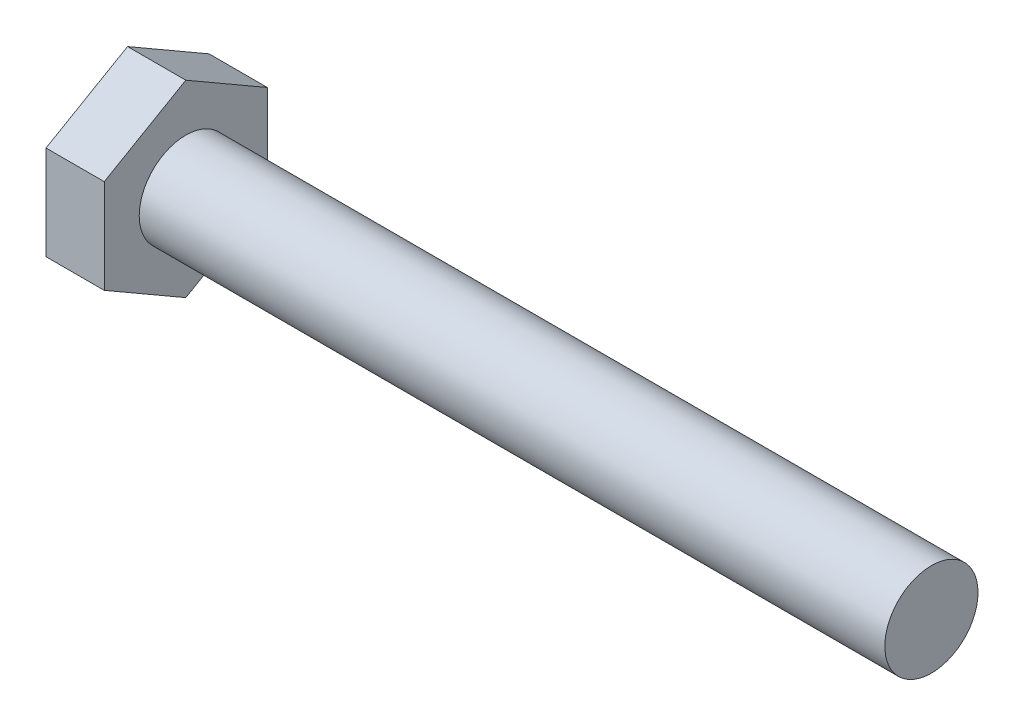
from build123d import *

# Parameters (mm, degrees)
SKETCH5_R           = 3.175
BOSS_EXTRUDE3_DEPTH = 50.8
BOSS_EXTRUDE4_DEPTH = 3.96875


with BuildPart() as part:
    # Sketch5 → Boss-Extrude3 (new body)
    with BuildSketch(Plane(origin=(27.384375, 0, 0), x_dir=(0, 0, -1), z_dir=(1, 0, 0))):
        Circle(SKETCH5_R)
    extrude(amount=-BOSS_EXTRUDE3_DEPTH)

    # Sketch11 → Revolve1 (revolve)
    with BuildSketch(Plane.XY):
        Polygon((-23.415625, 3.175), (-23.415625, 0), (11.509375, 0), (8.334375, 3.175), align=None)
    revolve(axis=Axis((-23.415625, 0, 0), (1, 0, 0)))

    # Sketch6 → Boss-Extrude4 (add)
    with BuildSketch(Plane.ZY.offset(23.415625)):
        Polygon((5.55625, 3.207902433), (0, 6.415804866), (-5.55625, 3.207902433), (-5.55625, -3.207902433), (0, -6.415804866), (5.55625, -3.207902433), align=None)
    extrude(amount=BOSS_EXTRUDE4_DEPTH)


solid = part.part
